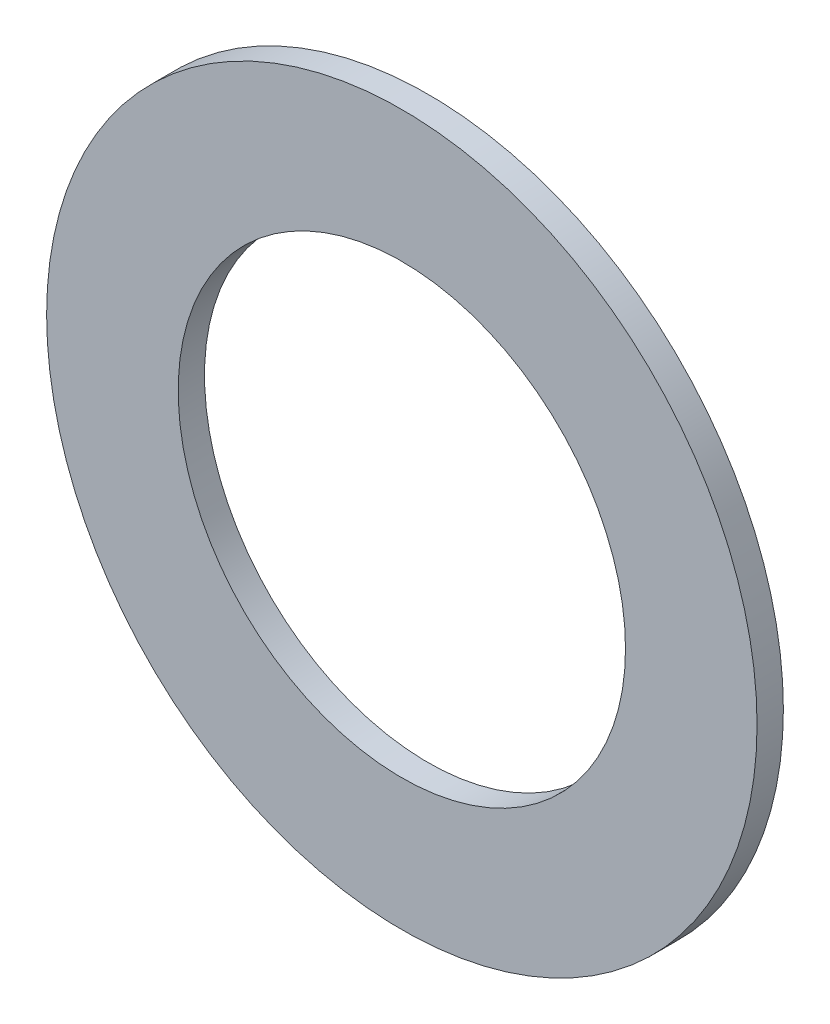
from build123d import *

# Parameters (mm, degrees)
SKETCH1_R           = 13.5
SKETCH1_R_2         = 8.5
BOSS_EXTRUDE1_DEPTH = 1


with BuildPart() as part:
    # Sketch1 → Boss-Extrude1 (new body)
    with BuildSketch(Plane.XY):
        Circle(SKETCH1_R)
        Circle(SKETCH1_R_2, mode=Mode.SUBTRACT)
    extrude(amount=BOSS_EXTRUDE1_DEPTH)


solid = part.part
